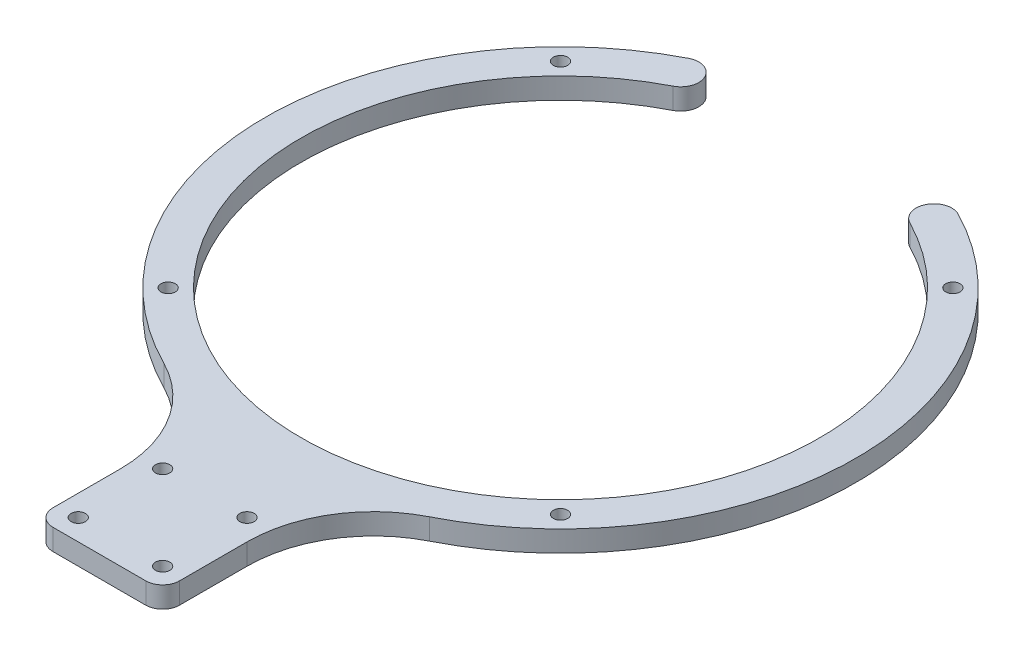
from build123d import *

# Parameters (mm, degrees)
BOSS_EXTRU_1_DEPTH = 5
D_GAGEMENT_M31_D   = 3.4


with BuildPart() as part:
    # Esquisse1 → Boss.-Extru.1 (new body)
    with BuildSketch(Plane(origin=(0, 0, 0), x_dir=(1, 0, 0), z_dir=(0, 1, 0))):
        with BuildLine():
            Line((-15, -89.302855497), (-15, -105.302855497))
            ThreePointArc((-15, -105.302855497), (-13.828427125, -108.131282622), (-11, -109.302855497))
            Line((-11, -109.302855497), (11, -109.302855497))
            ThreePointArc((11, -109.302855497), (13.828427125, -108.131282622), (15, -105.302855497))
            Line((15, -105.302855497), (15, -89.302855497))
            ThreePointArc((15, -89.302855497), (19.455920451, -73.570722775), (31.5, -62.511998848))
            ThreePointArc((31.5, -62.511998848), (69.999576157, -0.243593621), (31.934306569, 62.291251905))
            ThreePointArc((31.934306569, 62.291251905), (26.226929885, 60.452488359), (28.065693431, 54.745111675))
            ThreePointArc((28.065693431, 54.745111675), (0, -61.52), (-28.065693431, 54.745111675))
            ThreePointArc((-28.065693431, 54.745111675), (-26.226929885, 60.452488359), (-31.934306569, 62.291251905))
            ThreePointArc((-31.934306569, 62.291251905), (-69.999576157, -0.243593621), (-31.5, -62.511998848))
            ThreePointArc((-31.5, -62.511998848), (-19.455920451, -73.570722775), (-15, -89.302855497))
        make_face()
    extrude(amount=BOSS_EXTRU_1_DEPTH)

    # Dégagement M31 (through all)
    with Locations(Plane(origin=(0, 5, 0), x_dir=(1, 0, 0), z_dir=(0, 1, 0))):
        with Locations((46.5, 46.5), (46.5, -46.5), (-46.5, -46.5), (-46.5, 46.5), (-10, -84.302855497), (10, -84.302855497), (10, -104.302855497), (-10, -104.302855497)):
            Hole(D_GAGEMENT_M31_D / 2)


solid = part.part
